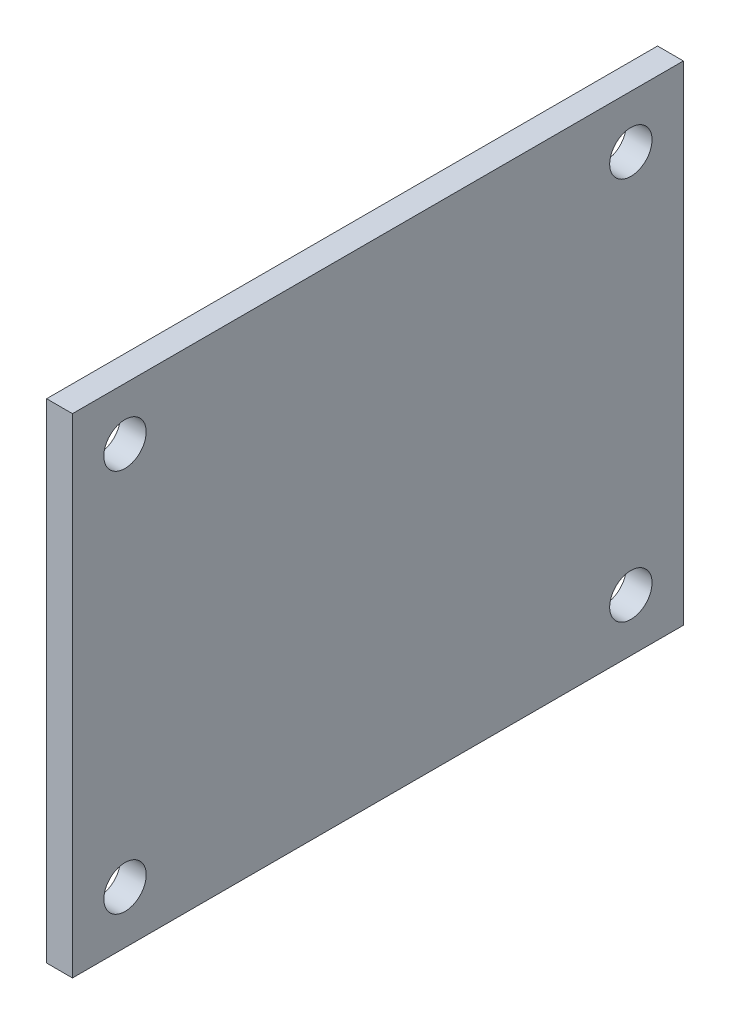
from build123d import *

# Parameters (mm, degrees)
BOSS_EXTRUDE1_DEPTH      = 1.5875
BOSS_EXTRUDE1_DEPTH_BACK = 1.5875
SKETCH1_W                = 75
SKETCH1_H                = 60
CUT_EXTRUDE1_DEPTH       = 49.049663435
CUT_EXTRUDE1_DEPTH_BACK  = 49.049663435
SKETCH2_R                = 2.6


with BuildPart() as part:
    # Sketch1 → Boss-Extrude1 (new, two sides: drawn at the far end of the back side and taken through both)
    with BuildSketch(Plane(origin=(0, 0, 0), x_dir=(0, 0, -1), z_dir=(1, 0, 0)).offset(-BOSS_EXTRUDE1_DEPTH_BACK)):
        Rectangle(SKETCH1_W, SKETCH1_H)
    extrude(amount=BOSS_EXTRUDE1_DEPTH + BOSS_EXTRUDE1_DEPTH_BACK)

    # Sketch2 → Cut-Extrude1 (cut, two sides: drawn at the far end of the back side and taken through both)
    with BuildSketch(Plane(origin=(0, 0, 0), x_dir=(0, 0, -1), z_dir=(1, 0, 0)).offset(-CUT_EXTRUDE1_DEPTH_BACK)):
        with Locations((-31.05, 23.55)):
            Circle(SKETCH2_R)
        with Locations((31.05, 23.55)):
            Circle(SKETCH2_R)
        with Locations((31.05, -23.55)):
            Circle(SKETCH2_R)
        with Locations((-31.05, -23.55)):
            Circle(SKETCH2_R)
    extrude(amount=CUT_EXTRUDE1_DEPTH + CUT_EXTRUDE1_DEPTH_BACK, mode=Mode.SUBTRACT)


solid = part.part
